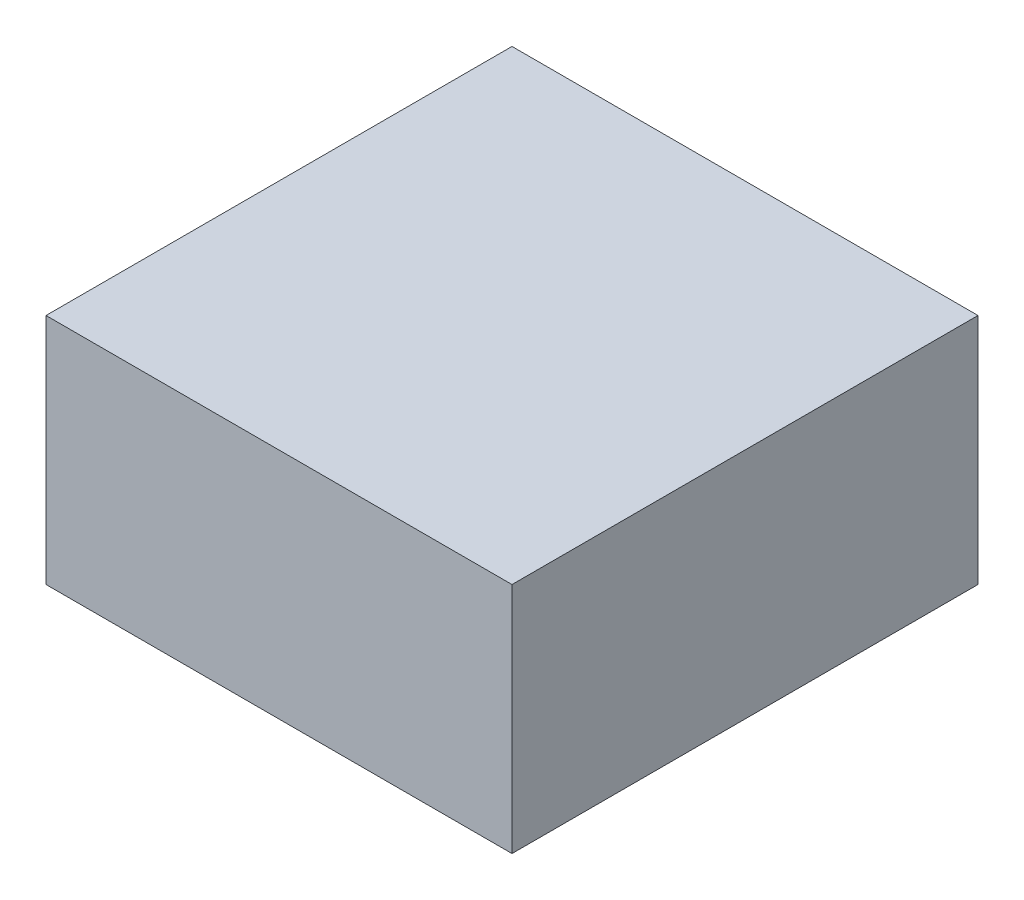
from build123d import *

# Parameters (mm, degrees)
SKETCH1_W           = 100
SKETCH1_H           = 100
BOSS_EXTRUDE1_DEPTH = 50


with BuildPart() as part:
    # Sketch1 → Boss-Extrude1 (new body)
    with BuildSketch(Plane(origin=(0, 0, 0), x_dir=(1, 0, 0), z_dir=(0, 1, 0))):
        Rectangle(SKETCH1_W, SKETCH1_H)
    extrude(amount=BOSS_EXTRUDE1_DEPTH)


solid = part.part
